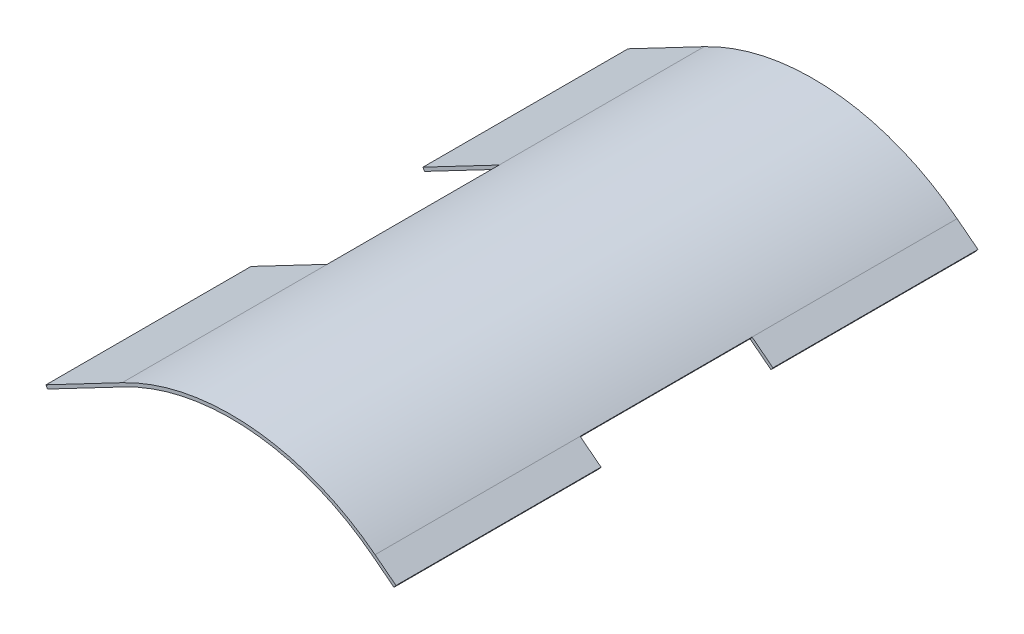
from build123d import *

# Parameters (mm, degrees)
EXTRUDE_THIN1_DEPTH     = 44
CUT_EXTRUDE1_REACH      = 92.628
SKETCH2_W               = 26
SKETCH2_H               = 13
CUT_EXTRUDE2_REACH      = 187.812
CUT_EXTRUDE2_END_RADIUS = 35
SKETCH3_W               = 4
SKETCH3_H               = 26


with BuildPart() as part:
    # Sketch1 → Extrude-Thin1 (new, symmetric)
    with BuildSketch(Plane.XY):
        with BuildLine():
            Line((-17.878642875, 190.536325772), (-21.038388075, 192.989081421))
            ThreePointArc((-21.038388075, 192.989081421), (-39.400871452, 200.203832377), (-58.748076809, 196.341310922))
            Line((-58.748076809, 196.341310922), (-70.262362524, 190.306310964))
            Line((-70.262362524, 190.306310964), (-70.494477907, 190.749168107))
            Line((-70.494477907, 190.749168107), (-58.980192192, 196.784168064))
            ThreePointArc((-58.980192192, 196.784168064), (-39.356598187, 200.701868398), (-20.731793619, 193.384049571))
            Line((-20.731793619, 193.384049571), (-17.572048419, 190.931293922))
            Line((-17.572048419, 190.931293922), (-17.878642875, 190.536325772))
        make_face()
    extrude(amount=EXTRUDE_THIN1_DEPTH, both=True)

    # Sketch2 → Cut-Extrude1 (cut, up to next)
    with BuildSketch(Plane(origin=(-93.623725178, 178.62640081, 0), x_dir=(0, 0, 1), z_dir=(-0.46423076597919966, 0.8857142857142849, 0)), mode=Mode.PRIVATE) as cut_extrude1_sk1:
        with Locations((0, 32.613666274)):
            Rectangle(SKETCH2_W, SKETCH2_H)
    cut_extrude1_tool1 = extrude(cut_extrude1_sk1.sketch, amount=-CUT_EXTRUDE1_REACH, mode=Mode.PRIVATE) & part.part
    add(cut_extrude1_tool1.solids().sort_by_distance((-64.737335, 193.766668, 0))[0], mode=Mode.SUBTRACT)

    # Cut-Extrude2: up to this cylinder (the profile starts outside it)
    cut_extrude2_end = Plane(origin=(-42.5, 165.341310922, 0), z_dir=(0, 0, -1)) * Cylinder(CUT_EXTRUDE2_END_RADIUS, 446.624, mode=Mode.PRIVATE)
    # Sketch3 → Cut-Extrude2 (cut, up to the surface)
    with BuildSketch(Plane(origin=(85.876233117, 110.62945285, 0), x_dir=(0.7899362999787406, -0.6131889121436371, 0), z_dir=(0.6131889121436371, 0.7899362999787406, 0)), mode=Mode.PRIVATE) as cut_extrude2_sk1:
        with Locations((-132.957751326, 0)):
            Rectangle(SKETCH3_W, SKETCH3_H)
    cut_extrude2_tool1 = extrude(cut_extrude2_sk1.sketch, amount=-CUT_EXTRUDE2_REACH, mode=Mode.PRIVATE) - cut_extrude2_end
    add(cut_extrude2_tool1.solids().sort_by_distance((-19.151921, 192.157672, 0))[0], mode=Mode.SUBTRACT)


solid = part.part
